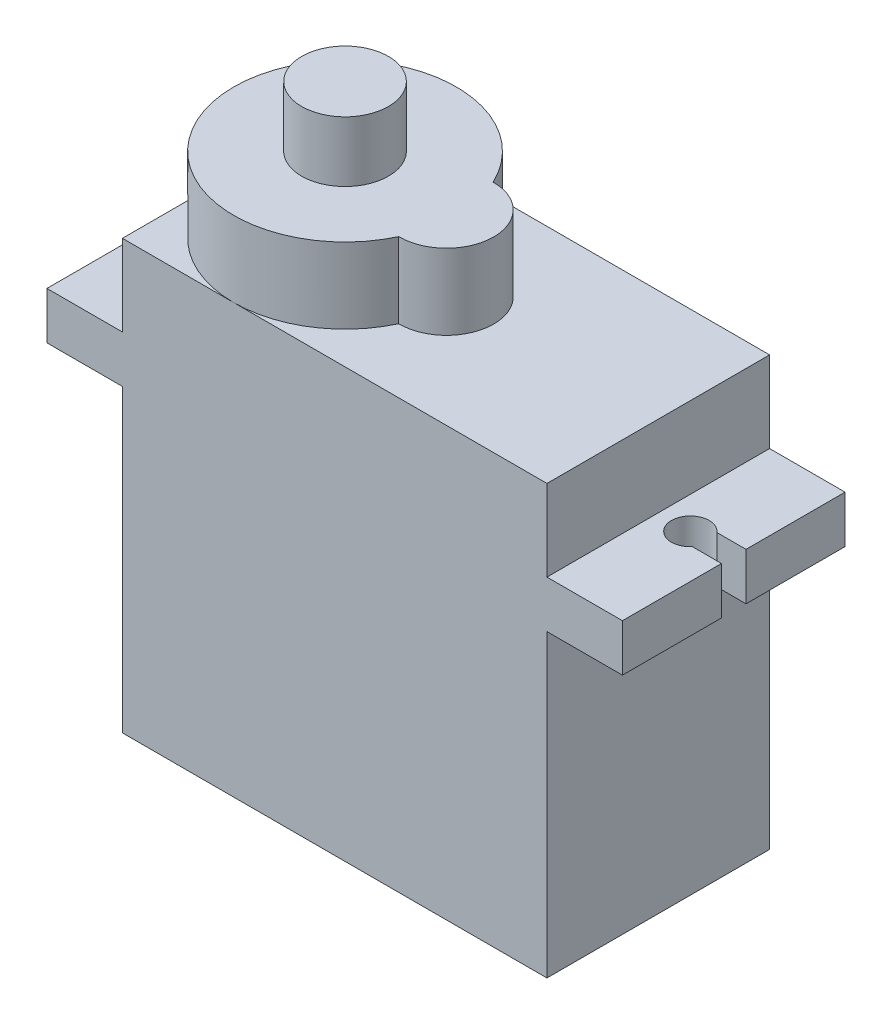
from build123d import *

# Parameters (mm, degrees)
SKETCH2_W                = 22.5
SKETCH2_H                = 22.7
BOSS_EXTRUDE1_DEPTH      = 11.8
SKETCH3_R                = 5.9
BOSS_EXTRUDE2_DEPTH      = 4
SKETCH4_R                = 2.3
BOSS_EXTRUDE3_DEPTH      = 3.2
BOSS_EXTRUDE4_DEPTH      = 4
BOSS_EXTRUDE4_DEPTH_BACK = 26.5
SKETCH5_W                = 11.8
SKETCH5_H                = 2.5
CUT_EXTRUDE1_REACH       = 32.014


with BuildPart() as part:
    # Sketch2 → Boss-Extrude1 (new body)
    with BuildSketch(Plane.XY):
        with Locations((5.317300213, 3.518634424)):
            Rectangle(SKETCH2_W, SKETCH2_H)
    extrude(amount=BOSS_EXTRUDE1_DEPTH)

    # Sketch3 → Boss-Extrude2 (add)
    with BuildSketch(Plane(origin=(0, 14.868634424, 0), x_dir=(1, 0, 0), z_dir=(0, 1, 0))):
        with Locations((-0.032699787, -5.9)):
            Circle(SKETCH3_R)
        with BuildLine():
            ThreePointArc((5.31155509, -3.400212046), (5.726688366, -4.619590646), (5.867300213, -5.9))
            ThreePointArc((5.867300213, -5.9), (5.726688366, -7.180409354), (5.31155509, -8.399787954))
            ThreePointArc((5.31155509, -8.399787954), (7.844115569, -5.9), (5.31155509, -3.400212046))
        make_face()
    extrude(amount=BOSS_EXTRUDE2_DEPTH)

    # Sketch4 → Boss-Extrude3 (add)
    with BuildSketch(Plane(origin=(0, 18.868634424, 0), x_dir=(1, 0, 0), z_dir=(0, 1, 0))):
        with Locations(Location((-0.032699787, -5.9, 0), (0, 0, 270))):
            Circle(SKETCH4_R)
    extrude(amount=BOSS_EXTRUDE3_DEPTH)

    # Sketch5 → Boss-Extrude4 (add, two sides: drawn at the far end of the back side and taken through both)
    with BuildSketch(Plane(origin=(16.567300213, 0, 0), x_dir=(0, 0, -1), z_dir=(1, 0, 0)).offset(-BOSS_EXTRUDE4_DEPTH_BACK)):
        with Locations((-5.9, 9.318634424)):
            Rectangle(SKETCH5_W, SKETCH5_H)
    extrude(amount=BOSS_EXTRUDE4_DEPTH + BOSS_EXTRUDE4_DEPTH_BACK)

    # Sketch7 → Cut-Extrude1 (cut, up to next)
    with BuildSketch(Plane(origin=(0, 10.568634424, 0), x_dir=(1, 0, 0), z_dir=(0, 1, 0)), mode=Mode.PRIVATE) as cut_extrude1_sk1:
        with BuildLine():
            Line((20.567300213, -6.55), (20.567300213, -5.25))
            Line((20.567300213, -5.25), (19.027234421, -5.25))
            ThreePointArc((19.027234421, -5.25), (17.267300213, -5.9), (19.027234421, -6.55))
            Line((19.027234421, -6.55), (20.567300213, -6.55))
        make_face()
    cut_extrude1_tool1 = extrude(cut_extrude1_sk1.sketch, amount=-CUT_EXTRUDE1_REACH, mode=Mode.PRIVATE) & part.part
    # Sketch7 → Cut-Extrude1 (cut, up to next)
    with BuildSketch(Plane(origin=(0, 10.568634424, 0), x_dir=(1, 0, 0), z_dir=(0, 1, 0)), mode=Mode.PRIVATE) as cut_extrude1_sk2:
        with BuildLine():
            ThreePointArc((-8.392633994, -4.9), (-6.632699787, -5.55), (-8.392633994, -6.2))
            Line((-8.392633994, -6.2), (-9.932699787, -6.2))
            Line((-9.932699787, -6.2), (-9.932699787, -4.9))
            Line((-9.932699787, -4.9), (-8.392633994, -4.9))
        make_face()
    cut_extrude1_tool2 = extrude(cut_extrude1_sk2.sketch, amount=-CUT_EXTRUDE1_REACH, mode=Mode.PRIVATE) & part.part
    add(cut_extrude1_tool1.solids().sort_by_distance((18.851481, 10.568634, 5.9))[0], mode=Mode.SUBTRACT)
    add(cut_extrude1_tool2.solids().sort_by_distance((-8.216881, 10.568634, 5.55))[0], mode=Mode.SUBTRACT)


solid = part.part
